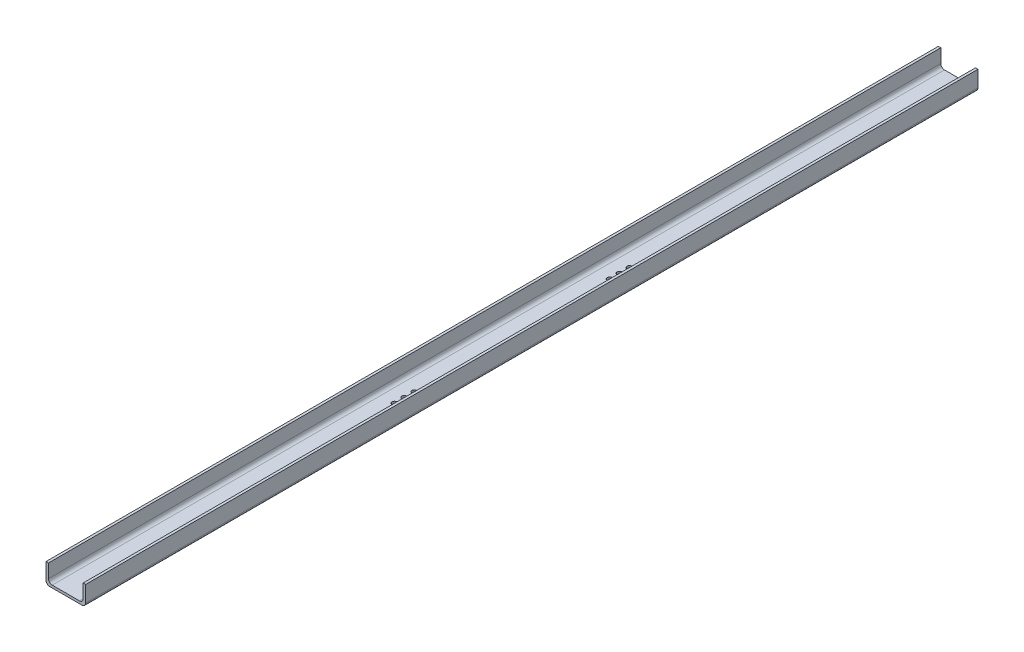
from build123d import *

# Parameters (mm, degrees)
BOSS_EXTRUDE1_DEPTH         = 1143
FILLET1_R                   = 4.7625
FILLET2_R                   = 4.7625
F_1_4_0_25_DIAMETER_HOLE1_D = 6.35


with BuildPart() as part:
    # Sketch1 → Boss-Extrude1 (new body)
    with BuildSketch(Plane.XY):
        Polygon((-25.4, 25.4), (-25.4, 0), (25.4, 0), (25.4, 25.4), (22.225, 25.4), (22.225, 3.175), (-22.225, 3.175), (-22.225, 25.4), align=None)
    extrude(amount=BOSS_EXTRUDE1_DEPTH)

    # Fillet1
    fillet1_edges = [part.edges().sort_by_distance(p)[0] for p in [
        (-22.225, 3.175, 571.5),
        (22.225, 3.175, 571.5),
    ]]
    fillet(fillet1_edges, radius=FILLET1_R)

    # Fillet2
    fillet2_edges = [part.edges().sort_by_distance(p)[0] for p in [
        (25.4, 0, 571.5),
        (-25.4, 0, 571.5),
    ]]
    fillet(fillet2_edges, radius=FILLET2_R)

    # 1/4 (0.25) Diameter Hole1 (through all)
    with Locations(Plane(origin=(0, 3.175, 0), x_dir=(1, 0, 0), z_dir=(0, 1, 0))):
        with Locations((0, -722), (0, -709.3), (0, -696.6), (0, -446.4), (0, -433.7), (0, -421)):
            Hole(F_1_4_0_25_DIAMETER_HOLE1_D / 2)


solid = part.part
